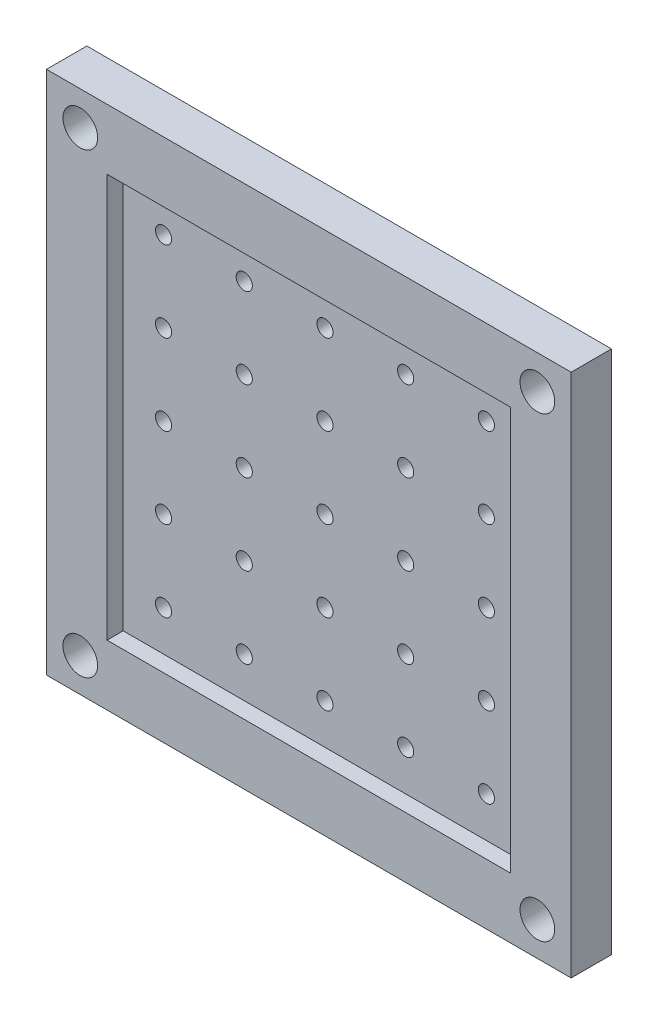
from build123d import *

# Parameters (mm, degrees)
SKETCH1_W           = 65
SKETCH1_H           = 65
SKETCH1_R           = 2.15
BOSS_EXTRUDE1_DEPTH = 3
SKETCH2_W           = 65
SKETCH2_H           = 65
SKETCH2_R           = 2.15
SKETCH2_W_2         = 50
SKETCH2_H_2         = 50
BOSS_EXTRUDE2_DEPTH = 2
SKETCH3_R           = 1
CUT_EXTRUDE1_DEPTH  = 47.059743812
CHAMFER1_SIZE       = 1.5
SKETCH4_W           = 50
SKETCH4_H           = 50
CUT_EXTRUDE2_DEPTH  = 1


with BuildPart() as part:
    # Sketch1 → Boss-Extrude1 (new body)
    with BuildSketch(Plane.XY):
        Rectangle(SKETCH1_W, SKETCH1_H)
        with Locations((-28.313708499, 28.313708499)):
            Circle(SKETCH1_R, mode=Mode.SUBTRACT)
        with Locations((-28.313708499, -28.313708499)):
            Circle(SKETCH1_R, mode=Mode.SUBTRACT)
        with Locations((28.313708499, -28.313708499)):
            Circle(SKETCH1_R, mode=Mode.SUBTRACT)
        with Locations((28.313708499, 28.313708499)):
            Circle(SKETCH1_R, mode=Mode.SUBTRACT)
    extrude(amount=BOSS_EXTRUDE1_DEPTH)

    # Sketch2 → Boss-Extrude2 (add)
    with BuildSketch(Plane.XY.offset(3)):
        Rectangle(SKETCH2_W, SKETCH2_H)
        with Locations((-28.313708499, -28.313708499)):
            Circle(SKETCH2_R, mode=Mode.SUBTRACT)
        with Locations((28.313708499, -28.313708499)):
            Circle(SKETCH2_R, mode=Mode.SUBTRACT)
        with Locations((-28.313708499, 28.313708499)):
            Circle(SKETCH2_R, mode=Mode.SUBTRACT)
        with Locations((28.313708499, 28.313708499)):
            Circle(SKETCH2_R, mode=Mode.SUBTRACT)
        Rectangle(SKETCH2_W_2, SKETCH2_H_2, mode=Mode.SUBTRACT)
    extrude(amount=BOSS_EXTRUDE2_DEPTH)

    # Sketch3 → Cut-Extrude1 (cut, through all)
    with BuildSketch(Plane.XY.offset(3)):
        with Locations((-20, -20)):
            Circle(SKETCH3_R)
        with Locations((-10, -20)):
            Circle(SKETCH3_R)
        with Locations((0, -20)):
            Circle(SKETCH3_R)
        with Locations((10, -20)):
            Circle(SKETCH3_R)
        with Locations((20, -20)):
            Circle(SKETCH3_R)
        with Locations((-10, -10)):
            Circle(SKETCH3_R)
        with Locations((0, -10)):
            Circle(SKETCH3_R)
        with Locations((10, -10)):
            Circle(SKETCH3_R)
        with Locations((20, -10)):
            Circle(SKETCH3_R)
        with Locations((-10, 0)):
            Circle(SKETCH3_R)
        Circle(SKETCH3_R)
        with Locations((10, 0)):
            Circle(SKETCH3_R)
        with Locations((20, 0)):
            Circle(SKETCH3_R)
        with Locations((-10, 10)):
            Circle(SKETCH3_R)
        with Locations((0, 10)):
            Circle(SKETCH3_R)
        with Locations((10, 10)):
            Circle(SKETCH3_R)
        with Locations((20, 10)):
            Circle(SKETCH3_R)
        with Locations((-10, 20)):
            Circle(SKETCH3_R)
        with Locations((0, 20)):
            Circle(SKETCH3_R)
        with Locations((10, 20)):
            Circle(SKETCH3_R)
        with Locations((20, 20)):
            Circle(SKETCH3_R)
        with Locations((-20, -10)):
            Circle(SKETCH3_R)
        with Locations((-20, 0)):
            Circle(SKETCH3_R)
        with Locations((-20, 10)):
            Circle(SKETCH3_R)
        with Locations((-20, 20)):
            Circle(SKETCH3_R)
    extrude(amount=-CUT_EXTRUDE1_DEPTH, mode=Mode.SUBTRACT)

    # Chamfer1
    chamfer1_edges = [part.edges().sort_by_distance(p)[0] for p in [
        (-30.463708499, 28.313708499, 0),
        (-30.463708499, -28.313708499, 0),
        (26.163708499, -28.313708499, 0),
        (26.163708499, 28.313708499, 0),
    ]]
    chamfer(chamfer1_edges, length=CHAMFER1_SIZE)

    # Sketch4 → Cut-Extrude2 (cut)
    with BuildSketch(Plane(origin=(0, 0, 0), x_dir=(-1, 0, 0), z_dir=(0, 0, -1))):
        Rectangle(SKETCH4_W, SKETCH4_H)
    extrude(amount=-CUT_EXTRUDE2_DEPTH, mode=Mode.SUBTRACT)


solid = part.part
